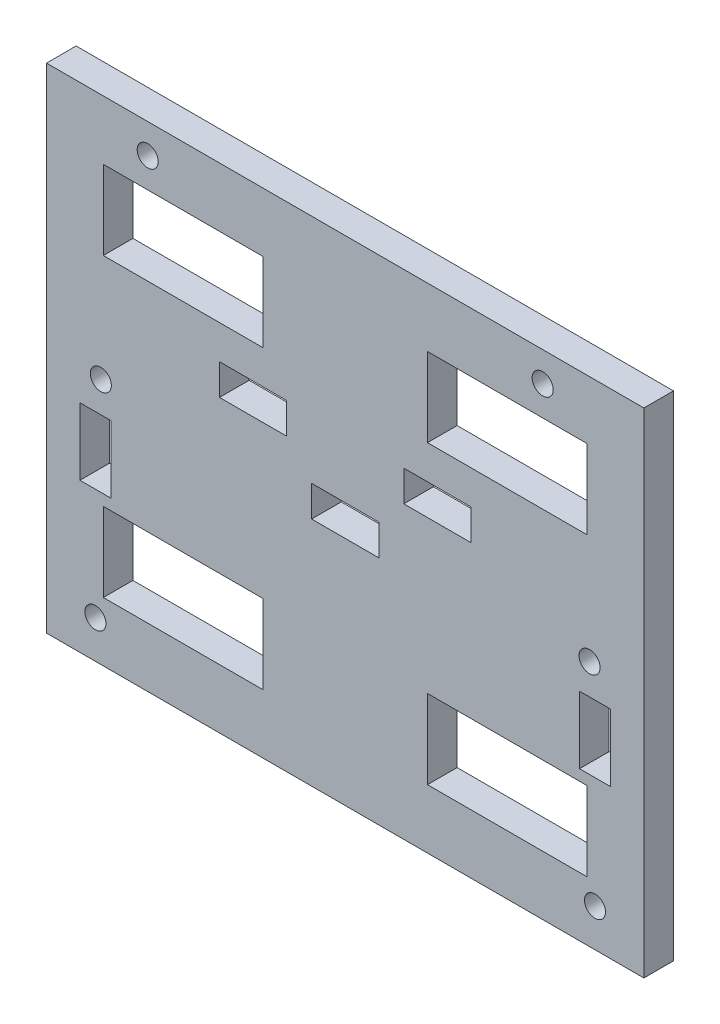
from build123d import *

# Parameters (mm, degrees)
SKETCH1_W           = 90.75
SKETCH1_H           = 75
SKETCH1_W_2         = 24.25
SKETCH1_H_2         = 12
BOSS_EXTRUDE1_DEPTH = 4.5
SKETCH2_R           = 1.6
SCREWHOLES_DEPTH    = 60.037196961
SKETCH3_W           = 10.2
SKETCH3_H           = 4.7
BELTCLAMP_DEPTH     = 60.037196961
SKETCH4_W           = 10.2
SKETCH4_H           = 4.7
CUT_EXTRUDE3_DEPTH  = 60.037196961
SKETCH5_R           = 1.6
SKETCH5_W           = 4.7
SKETCH5_H           = 10.2
CUT_EXTRUDE4_DEPTH  = 60.037196961


with BuildPart() as part:
    # Sketch1 → Boss-Extrude1 (new body)
    with BuildSketch(Plane.XY):
        Rectangle(SKETCH1_W, SKETCH1_H)
        with Locations((-24.625, 22.5)):
            Rectangle(SKETCH1_W_2, SKETCH1_H_2, mode=Mode.SUBTRACT)
        with Locations((24.625, 22.5)):
            Rectangle(SKETCH1_W_2, SKETCH1_H_2, mode=Mode.SUBTRACT)
        with Locations((24.625, -22.5)):
            Rectangle(SKETCH1_W_2, SKETCH1_H_2, mode=Mode.SUBTRACT)
        with Locations((-24.625, -22.5)):
            Rectangle(SKETCH1_W_2, SKETCH1_H_2, mode=Mode.SUBTRACT)
    extrude(amount=BOSS_EXTRUDE1_DEPTH)

    # Sketch2 → screwHoles (cut, through all)
    with BuildSketch(Plane.XY.offset(4.5)):
        with Locations((-30, 33)):
            Circle(SKETCH2_R)
        with Locations(Location((30, 33, 0), (0, 0, 180))):
            Circle(SKETCH2_R)
        with Locations((37.125, 0)):
            Circle(SKETCH2_R)
        with Locations(Location((-37.125, 0, 0), (0, 0, 180))):
            Circle(SKETCH2_R)
    extrude(amount=-SCREWHOLES_DEPTH, mode=Mode.SUBTRACT)

    # Sketch3 → BeltClamp (cut, through all)
    with BuildSketch(Plane.XY.offset(4.5)):
        with Locations((-14, 9)):
            Rectangle(SKETCH3_W, SKETCH3_H)
        with Locations((14, 9)):
            Rectangle(SKETCH3_W, SKETCH3_H)
    extrude(amount=-BELTCLAMP_DEPTH, mode=Mode.SUBTRACT)

    # Sketch4 → Cut-Extrude3 (cut, through all)
    with BuildSketch(Plane.XY.offset(4.5)):
        Rectangle(SKETCH4_W, SKETCH4_H)
    extrude(amount=-CUT_EXTRUDE3_DEPTH, mode=Mode.SUBTRACT)

    # Sketch5 → Cut-Extrude4 (cut, through all)
    with BuildSketch(Plane.XY.offset(4.5)):
        with Locations((37.95, -31.75)):
            Circle(SKETCH5_R)
        with Locations(Location((-37.95, -31.75, 0), (0, 0, 180))):
            Circle(SKETCH5_R)
        with Locations((37.95, -9.75)):
            Rectangle(SKETCH5_W, SKETCH5_H)
        with Locations((-37.95, -9.75)):
            Rectangle(SKETCH5_W, SKETCH5_H)
    extrude(amount=-CUT_EXTRUDE4_DEPTH, mode=Mode.SUBTRACT)


solid = part.part
